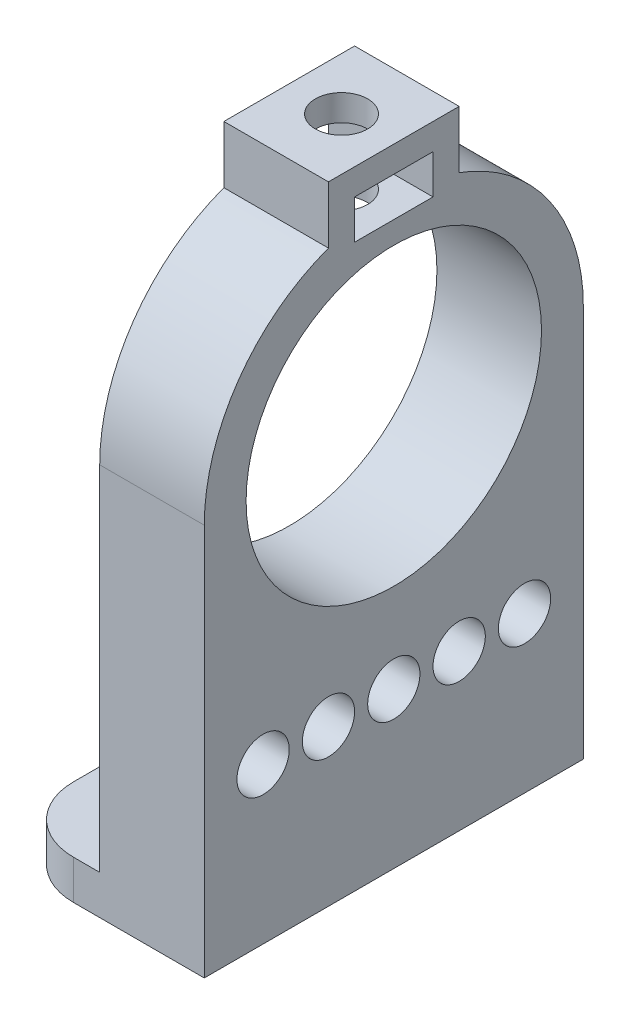
from build123d import *

# Parameters (mm, degrees)
SKETCH15_R           = 11.5
BOSS_EXTRUDE8_DEPTH  = 8
BOSS_EXTRUDE9_START  = -8
SKETCH16_R           = 11.5
SKETCH16_R_2         = 11.3
BOSS_EXTRUDE9_DEPTH  = 8
SKETCH17_W           = 10
SKETCH17_H           = 3
BOSS_EXTRUDE10_DEPTH = 8
SKETCH18_W           = 8
SKETCH18_H           = 10
BOSS_EXTRUDE11_DEPTH = 2
SKETCH19_W           = 6
SKETCH19_H           = 3
CUT_EXTRUDE4_DEPTH   = 8
SKETCH20_R           = 2
CUT_EXTRUDE5_DEPTH   = 9
SKETCH21_W           = 29
SKETCH21_H           = 3
BOSS_EXTRUDE12_DEPTH = 7
SKETCH22_R           = 2
CUT_EXTRUDE6_DEPTH   = 7
FILLET1_R            = 5
SKETCH24_R           = 2
CUT_EXTRUDE10_DEPTH  = 8


with BuildPart() as part:
    # Sketch15 → Boss-Extrude8 (new body)
    with BuildSketch(Plane(origin=(3.715547427, 0, 0), x_dir=(0, 0, -1), z_dir=(1, 0, 0))):
        with BuildLine():
            Line((33.146692928, -20.712987114), (4.146692928, -20.712987114))
            Line((4.146692928, -20.712987114), (4.146692928, 9.287012886))
            ThreePointArc((4.146692928, 9.287012886), (18.646692928, 23.787012886), (33.146692928, 9.287012886))
            Line((33.146692928, 9.287012886), (33.146692928, -20.712987114))
        make_face()
        with Locations((18.646692928, 9.287012886)):
            Circle(SKETCH15_R, mode=Mode.SUBTRACT)
    extrude(amount=-BOSS_EXTRUDE8_DEPTH)

    # Sketch16 → Boss-Extrude9 (add)
    with BuildSketch(Plane.ZY.offset(4.284452573).offset(BOSS_EXTRUDE9_START)):
        with Locations((-18.646692928, 9.287012886)):
            Circle(SKETCH16_R)
        with Locations((-18.646692928, 9.287012886)):
            Circle(SKETCH16_R_2, mode=Mode.SUBTRACT)
    extrude(amount=BOSS_EXTRUDE9_DEPTH)

    # Sketch17 → Boss-Extrude10 (add)
    with BuildSketch(Plane.ZY.offset(4.284452573)):
        with Locations((-18.646692928, 23.787012886)):
            Rectangle(SKETCH17_W, SKETCH17_H)
    extrude(amount=-BOSS_EXTRUDE10_DEPTH)

    # Sketch18 → Boss-Extrude11 (add)
    with BuildSketch(Plane(origin=(0, 25.287012886, 0), x_dir=(1, 0, 0), z_dir=(0, 1, 0))):
        with Locations((-0.284452573, 18.646692928)):
            Rectangle(SKETCH18_W, SKETCH18_H)
    extrude(amount=BOSS_EXTRUDE11_DEPTH)

    # Sketch19 → Cut-Extrude4 (cut)
    with BuildSketch(Plane.ZY.offset(4.284452573)):
        with Locations((-18.646692928, 23.787012886)):
            Rectangle(SKETCH19_W, SKETCH19_H)
    extrude(amount=-CUT_EXTRUDE4_DEPTH, mode=Mode.SUBTRACT)

    # Sketch20 → Cut-Extrude5 (cut)
    with BuildSketch(Plane(origin=(0, 27.287012886, 0), x_dir=(1, 0, 0), z_dir=(0, 1, 0))):
        with Locations(Location((-0.284452573, 18.646692928, 0), (0, 0, 270))):
            Circle(SKETCH20_R)
    extrude(amount=-CUT_EXTRUDE5_DEPTH, mode=Mode.SUBTRACT)

    # Sketch21 → Boss-Extrude12 (add)
    with BuildSketch(Plane.ZY.offset(4.284452573)):
        with Locations((-18.646692928, -19.212987114)):
            Rectangle(SKETCH21_W, SKETCH21_H)
    extrude(amount=BOSS_EXTRUDE12_DEPTH)

    # Sketch22 → Cut-Extrude6 (cut)
    with BuildSketch(Plane(origin=(0, -17.712987114, 0), x_dir=(1, 0, 0), z_dir=(0, 1, 0))):
        with Locations(Location((-7.784452573, 11.396692928, 0), (0, 0, 180))):
            Circle(SKETCH22_R)
        with Locations(Location((-7.784452573, 18.646692928, 0), (0, 0, 180))):
            Circle(SKETCH22_R)
        with Locations(Location((-7.784452573, 25.896692928, 0), (0, 0, 180))):
            Circle(SKETCH22_R)
    extrude(amount=-CUT_EXTRUDE6_DEPTH, mode=Mode.SUBTRACT)

    # Fillet1
    fillet1_edges = [part.edges().sort_by_distance(p)[0] for p in [
        (-11.284452573, -19.212987114, -33.146692928),
        (-11.284452573, -19.212987114, -4.146692928),
    ]]
    fillet(fillet1_edges, radius=FILLET1_R)

    # Sketch24 → Cut-Extrude10 (cut)
    with BuildSketch(Plane.ZY.offset(4.284452573)):
        with Locations((-18.646692928, -8.812987114)):
            Circle(SKETCH24_R)
        with Locations((-13.646692928, -8.812987114)):
            Circle(SKETCH24_R)
        with Locations((-23.646692928, -8.812987114)):
            Circle(SKETCH24_R)
        with Locations((-28.646692928, -8.812987114)):
            Circle(SKETCH24_R)
        with Locations((-8.646692928, -8.812987114)):
            Circle(SKETCH24_R)
    extrude(amount=-CUT_EXTRUDE10_DEPTH, mode=Mode.SUBTRACT)


solid = part.part
